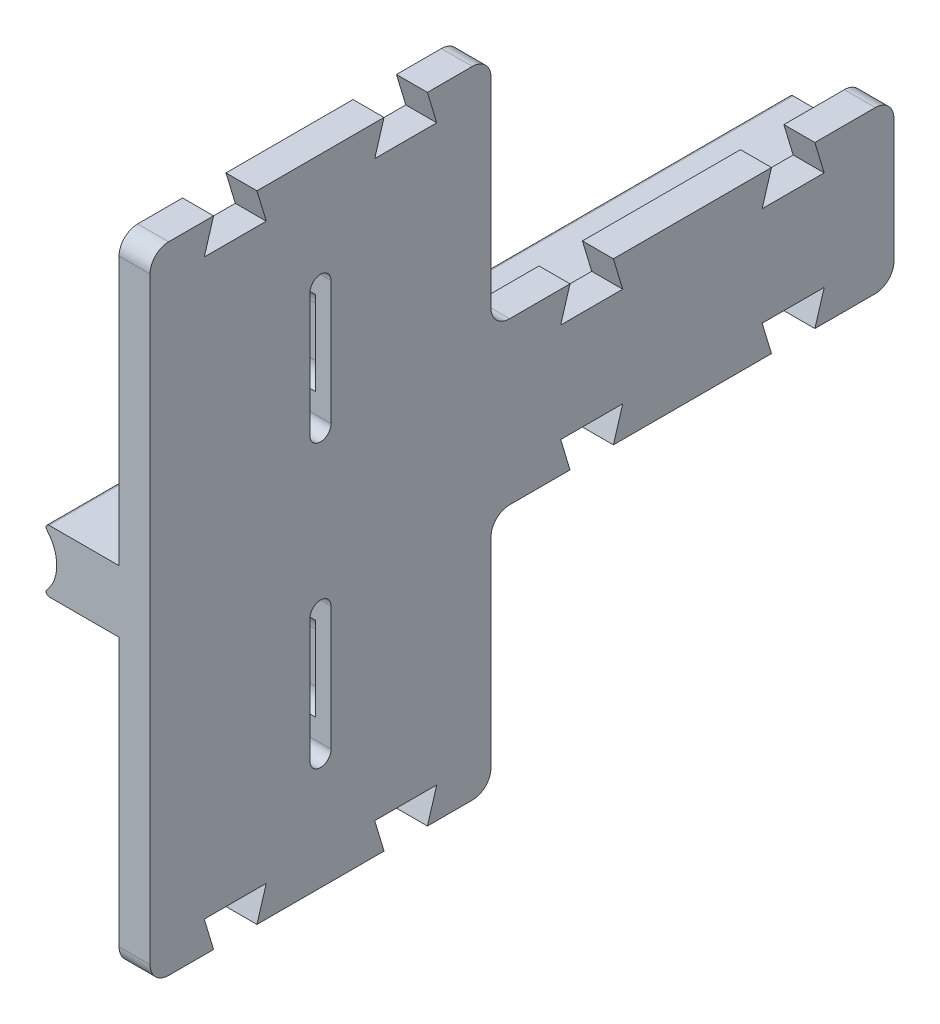
from build123d import *

# Parameters (mm, degrees)
SKETCH1_W           = 55
SKETCH1_H           = 78.5
BOSS_EXTRUDE1_DEPTH = 2.5
SKETCH6_W           = 55
SKETCH6_H           = 10
BOSS_EXTRUDE2_DEPTH = 16.3
CUT_EXTRUDE1_DEPTH  = 71.135600803
SKETCH9_W           = 55
SKETCH9_H           = 12
BOSS_EXTRUDE3_DEPTH = 5
CUT_EXTRUDE4_DEPTH  = 5
CUT_EXTRUDE2_DEPTH  = 2.5
BOSS_EXTRUDE4_DEPTH = 65
FILLET1_R           = 0.5
CUT_EXTRUDE3_DEPTH  = 5
FILLET2_R           = 3


with BuildPart() as part:
    # Sketch1 → Boss-Extrude1 (new, symmetric)
    with BuildSketch(Plane(origin=(0, 0, 0), x_dir=(0, 0, -1), z_dir=(1, 0, 0))):
        Rectangle(SKETCH1_W, SKETCH1_H)
        with BuildLine():
            Line((-1.7, -32.75), (-1.7, -12.75))
            ThreePointArc((-1.7, -12.75), (0, -11.05), (1.7, -12.75))
            Line((1.7, -12.75), (1.7, -32.75))
            ThreePointArc((1.7, -32.75), (0, -34.45), (-1.7, -32.75))
        make_face(mode=Mode.SUBTRACT)
        with BuildLine():
            Line((-1.7, 32.75), (-1.7, 12.75))
            ThreePointArc((-1.7, 12.75), (0, 11.05), (1.7, 12.75))
            Line((1.7, 12.75), (1.7, 32.75))
            ThreePointArc((1.7, 32.75), (0, 34.45), (-1.7, 32.75))
        make_face(mode=Mode.SUBTRACT)
    extrude(amount=BOSS_EXTRUDE1_DEPTH, both=True)

    # Sketch6 → Boss-Extrude2 (add)
    with BuildSketch(Plane.ZY.offset(2.5)):
        Rectangle(SKETCH6_W, SKETCH6_H)
    extrude(amount=BOSS_EXTRUDE2_DEPTH)

    # Sketch7 → Cut-Extrude1 (cut, through all)
    with BuildSketch(Plane.XY.offset(27.5)):
        with BuildLine():
            Line((-15.05, 5), (-18.8, 5))
            Line((-18.8, 5), (-18.8, -5))
            Line((-18.8, -5), (-15.05, -5))
            ThreePointArc((-15.05, -5), (-12.55, 0), (-15.05, 5))
        make_face()
    extrude(amount=-CUT_EXTRUDE1_DEPTH, mode=Mode.SUBTRACT)

    # Sketch9 → Boss-Extrude3 (add)
    with BuildSketch(Plane.ZY.offset(2.5)):
        with Locations((0, 45.25)):
            Rectangle(SKETCH9_W, SKETCH9_H)
    boss_extrude3 = extrude(amount=-BOSS_EXTRUDE3_DEPTH)

    # Sketch16 → Cut-Extrude4 (cut)
    with BuildSketch(Plane.ZY.offset(2.5)):
        Polygon((10.25, 51.25), (17.25, 51.25), (18.75, 46.25), (8.75, 46.25), align=None)
        Polygon((-18.75, 46.25), (-8.75, 46.25), (-10.25, 51.25), (-17.25, 51.25), align=None)
    cut_extrude4 = extrude(amount=-CUT_EXTRUDE4_DEPTH, mode=Mode.SUBTRACT)

    # Mirror1: Boss-Extrude3 across plane
    add(boss_extrude3.mirror(Plane.ZX))

    # Sketch10 → Cut-Extrude2 (cut)
    with BuildSketch(Plane(origin=(0, 0, 0), x_dir=(0, 0, -1), z_dir=(1, 0, 0))):
        with BuildLine():
            Line((3.25, -18.75), (3.25, -26.75))
            ThreePointArc((3.25, -26.75), (0, -30), (-3.25, -26.75))
            Line((-3.25, -26.75), (-3.25, -18.75))
            ThreePointArc((-3.25, -18.75), (0, -15.5), (3.25, -18.75))
        make_face()
        with BuildLine():
            Line((3.25, 18.75), (3.25, 26.75))
            ThreePointArc((3.25, 26.75), (0, 30), (-3.25, 26.75))
            Line((-3.25, 26.75), (-3.25, 18.75))
            ThreePointArc((-3.25, 18.75), (0, 15.5), (3.25, 18.75))
        make_face()
    extrude(amount=-CUT_EXTRUDE2_DEPTH, mode=Mode.SUBTRACT)

    # Sketch11 → Boss-Extrude4 (add)
    with BuildSketch(Plane(origin=(0, 0, -27.5), x_dir=(-1, 0, 0), z_dir=(0, 0, -1))):
        with BuildLine():
            Line((-2.5, -13), (2.5, -13))
            Line((2.5, -13), (2.5, -5))
            Line((2.5, -5), (15.05, -5))
            ThreePointArc((15.05, -5), (12.55, 0), (15.05, 5))
            Line((15.05, 5), (2.5, 5))
            Line((2.5, 5), (2.5, 13))
            Line((2.5, 13), (-2.5, 13))
            Line((-2.5, 13), (-2.5, -13))
        make_face()
    extrude(amount=BOSS_EXTRUDE4_DEPTH)

    # Fillet1
    fillet1_edges = [part.edges().sort_by_distance(p)[0] for p in [
        (-15.05, 5, -32.5),
        (-15.05, -5, -32.5),
    ]]
    fillet(fillet1_edges, radius=FILLET1_R)

    # Sketch15 → Cut-Extrude3 (cut)
    with BuildSketch(Plane.ZY.offset(2.5)):
        Polygon((-40.25, 13), (-38.75, 8), (-48.75, 8), (-47.25, 13), align=None)
        Polygon((-72.75, 13), (-79.75, 13), (-81.25, 8), (-71.25, 8), align=None)
    cut_extrude3 = extrude(amount=-CUT_EXTRUDE3_DEPTH, mode=Mode.SUBTRACT)

    # Mirror2: Cut-Extrude3 across plane
    add(cut_extrude3.mirror(Plane.ZX), mode=Mode.SUBTRACT)

    # Mirror3: Cut-Extrude4 across plane
    add(cut_extrude4.mirror(Plane.ZX), mode=Mode.SUBTRACT)

    # Fillet2
    fillet2_edges = [part.edges().sort_by_distance(p)[0] for p in [
        (0, -51.25, 27.5),
        (0, -51.25, -27.5),
        (0, 13, -27.5),
        (0, -13, -27.5),
        (0, 13, -92.5),
        (0, -13, -92.5),
        (0, 51.25, -27.5),
        (0, 51.25, 27.5),
    ]]
    fillet(fillet2_edges, radius=FILLET2_R)


solid = part.part
